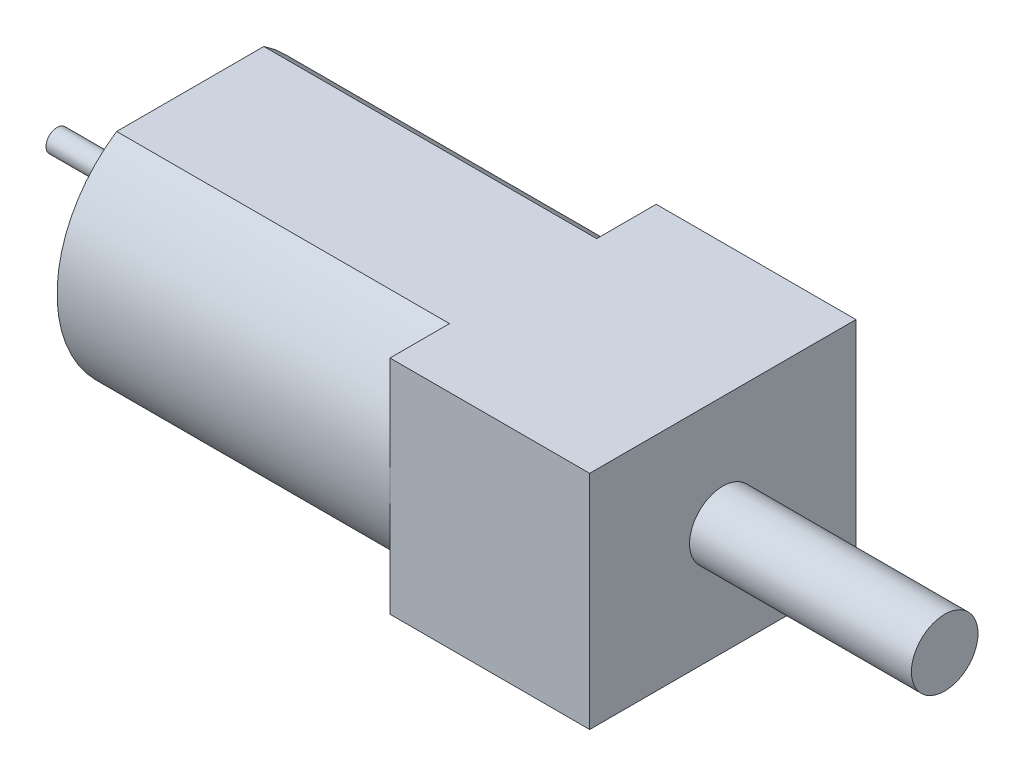
from build123d import *

# Parameters (mm, degrees)
SKETCH2_W           = 12
SKETCH2_H           = 10
BOSS_EXTRUDE1_DEPTH = 24
SKETCH3_R           = 1.5
BOSS_EXTRUDE2_DEPTH = 10
SKETCH4_OUTSIDE_W   = 21.484
SKETCH4_OUTSIDE_H   = 19.484
SKETCH4_OUTSIDE_R   = 6
CUT_EXTRUDE1_DEPTH  = 15
SKETCH5_R           = 0.5
BOSS_EXTRUDE3_DEPTH = 6


with BuildPart() as part:
    # Sketch2 → Boss-Extrude1 (new body)
    with BuildSketch(Plane(origin=(0, 0, 0), x_dir=(0, 0, -1), z_dir=(1, 0, 0))):
        with Locations((6, 5)):
            Rectangle(SKETCH2_W, SKETCH2_H)
    extrude(amount=BOSS_EXTRUDE1_DEPTH)

    # Sketch3 → Boss-Extrude2 (add)
    with BuildSketch(Plane(origin=(24, 0, 0), x_dir=(0, 0, -1), z_dir=(1, 0, 0))):
        with Locations((6, 5)):
            Circle(SKETCH3_R)
    extrude(amount=BOSS_EXTRUDE2_DEPTH)

    # Sketch4 outside → Cut-Extrude1 (cut)
    with BuildSketch(Plane.ZY):
        with Locations((-6, 5)):
            Rectangle(SKETCH4_OUTSIDE_W, SKETCH4_OUTSIDE_H)
        with Locations((-6, 5)):
            Circle(SKETCH4_OUTSIDE_R, mode=Mode.SUBTRACT)
    extrude(amount=-CUT_EXTRUDE1_DEPTH, mode=Mode.SUBTRACT)

    # Sketch5 → Boss-Extrude3 (add)
    with BuildSketch(Plane.ZY):
        with Locations((-6, 5)):
            Circle(SKETCH5_R)
    extrude(amount=BOSS_EXTRUDE3_DEPTH)


solid = part.part
